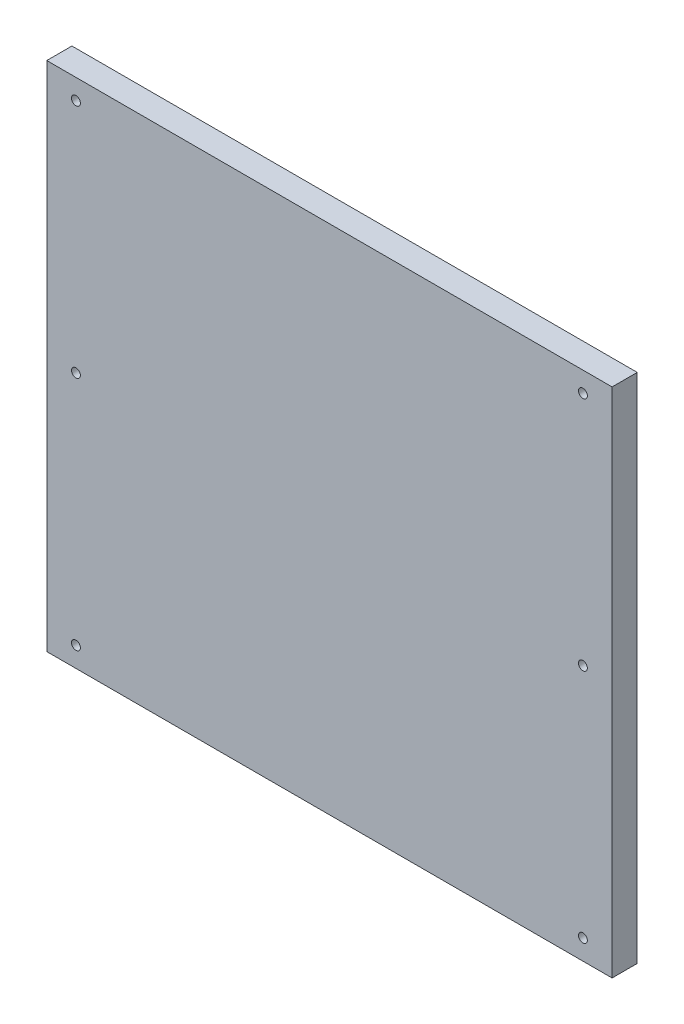
from build123d import *

# Parameters (mm, degrees)
SKETCH1_W           = 428.225
SKETCH1_H           = 387.75
BOSS_EXTRUDE1_DEPTH = 19.05
SKETCH2_R           = 3.3655
CUT_EXTRUDE1_DEPTH  = 324.427773516
SKETCH3_R           = 3.3655
CUT_EXTRUDE2_DEPTH  = 324.427773516
SKETCH4_R           = 3.3655
CUT_EXTRUDE3_DEPTH  = 25.4


with BuildPart() as part:
    # Sketch1 → Boss-Extrude1 (new body)
    with BuildSketch(Plane.XY.offset(1063.625)):
        with Locations((0, 47.625)):
            Rectangle(SKETCH1_W, SKETCH1_H)
    extrude(amount=BOSS_EXTRUDE1_DEPTH)

    # Sketch2 → Cut-Extrude1 (cut, through all)
    with BuildSketch(Plane(origin=(0, 0, 1061.72), x_dir=(1, 0, 0), z_dir=(0, 0, -1))):
        with Locations(Location((192.0145, 131.01, 0), (0, 0, 270))):
            Circle(SKETCH2_R)
    cut_extrude1 = extrude(amount=-CUT_EXTRUDE1_DEPTH, mode=Mode.SUBTRACT)

    # Sketch3 → Cut-Extrude2 (cut, through all)
    with BuildSketch(Plane(origin=(0, 0, 1061.72), x_dir=(1, 0, 0), z_dir=(0, 0, -1))):
        with Locations(Location((192.0145, -47.625, 0), (0, 0, 270))):
            Circle(SKETCH3_R)
    cut_extrude2 = extrude(amount=-CUT_EXTRUDE2_DEPTH, mode=Mode.SUBTRACT)

    # Sketch4 → Cut-Extrude3 (cut)
    with BuildSketch(Plane(origin=(0, 0, 1061.72), x_dir=(1, 0, 0), z_dir=(0, 0, -1))):
        with Locations((192.0145, -226.26)):
            Circle(SKETCH4_R)
    cut_extrude3 = extrude(amount=-CUT_EXTRUDE3_DEPTH, mode=Mode.SUBTRACT)

    # Mirror1: Cut-Extrude1, Cut-Extrude2, Cut-Extrude3 across plane
    add(cut_extrude1.mirror(Plane(origin=(0, 0, 0), x_dir=(0, 0, 1), z_dir=(1, 0, 0))), mode=Mode.SUBTRACT)
    add(cut_extrude2.mirror(Plane(origin=(0, 0, 0), x_dir=(0, 0, 1), z_dir=(1, 0, 0))), mode=Mode.SUBTRACT)
    add(cut_extrude3.mirror(Plane(origin=(0, 0, 0), x_dir=(0, 0, 1), z_dir=(1, 0, 0))), mode=Mode.SUBTRACT)


solid = part.part
